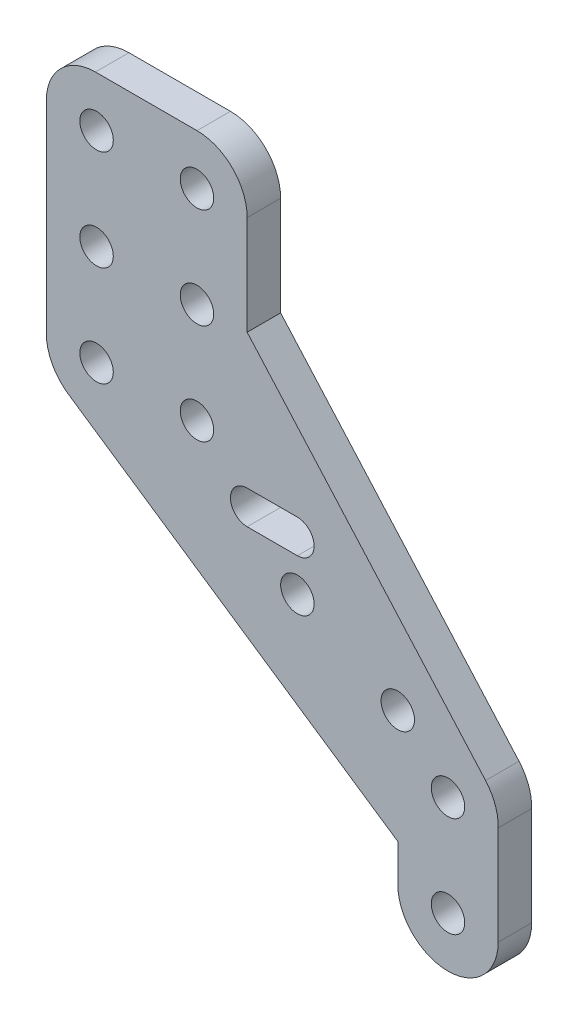
from build123d import *

# Parameters (mm, degrees)
MODEL_R                 = 1.5
SALIENTE_EXTRUIR1_DEPTH = 3


with BuildPart() as part:
    # Model → Saliente-Extruir1 (new body)
    with BuildSketch(Plane.XY):
        with BuildLine():
            Line((47.956564936, 294.416156902), (47.956564936, 276.316156902))
            ThreePointArc((47.956564936, 276.316156902), (48.482384187, 274.205259611), (49.936959325, 272.587673623))
            Line((49.936959325, 272.587673623), (70.456564936, 258.72109315))
            Line((70.456564936, 258.72109315), (79.456564936, 252.639142716))
            Line((79.456564936, 252.639142716), (79.456564936, 249.316156902))
            ThreePointArc((79.456564936, 249.316156902), (83.956564936, 244.816156902), (88.456564936, 249.316156902))
            Line((88.456564936, 249.316156902), (88.456564456, 249.318235809))
            Line((88.456564456, 249.318235809), (88.454517382, 258.180422621))
            ThreePointArc((88.454517382, 258.180422621), (88.187667044, 259.848401972), (87.32462533, 261.300477459))
            Line((87.32462533, 261.300477459), (65.956564936, 285.416156902))
            Line((65.956564936, 285.416156902), (65.956564936, 294.316156902))
            ThreePointArc((65.956564936, 294.316156902), (64.638545451, 297.498137417), (61.456564936, 298.816156902))
            Line((61.456564936, 298.816156902), (52.356564936, 298.816156902))
            ThreePointArc((52.356564936, 298.816156902), (49.245295099, 297.527426739), (47.956564936, 294.416156902))
        make_face()
        with Locations((83.956564936, 249.316156902)):
            Circle(MODEL_R, mode=Mode.SUBTRACT)
        with Locations((70.456564936, 267.316156902)):
            Circle(MODEL_R, mode=Mode.SUBTRACT)
        with Locations((79.456564936, 262.816156902)):
            Circle(MODEL_R, mode=Mode.SUBTRACT)
        with Locations((83.956564936, 258.316156902)):
            Circle(MODEL_R, mode=Mode.SUBTRACT)
        with Locations((52.456564936, 276.316156902)):
            Circle(MODEL_R, mode=Mode.SUBTRACT)
        with Locations((61.456564936, 276.316156902)):
            Circle(MODEL_R, mode=Mode.SUBTRACT)
        with BuildLine():
            ThreePointArc((65.956564936, 270.316156902), (64.456564936, 271.816156902), (65.956564936, 273.316156902))
            Line((65.956564936, 273.316156902), (70.456564936, 273.316156902))
            ThreePointArc((70.456564936, 273.316156902), (71.956564936, 271.816156902), (70.456564936, 270.316156902))
            Line((70.456564936, 270.316156902), (65.956564936, 270.316156902))
        make_face(mode=Mode.SUBTRACT)
        with Locations((52.456564936, 285.316156902)):
            Circle(MODEL_R, mode=Mode.SUBTRACT)
        with Locations((52.456564936, 294.316156902)):
            Circle(MODEL_R, mode=Mode.SUBTRACT)
        with Locations((61.456564936, 285.316156902)):
            Circle(MODEL_R, mode=Mode.SUBTRACT)
        with Locations((61.456564936, 294.316156902)):
            Circle(MODEL_R, mode=Mode.SUBTRACT)
    extrude(amount=SALIENTE_EXTRUIR1_DEPTH)


solid = part.part
